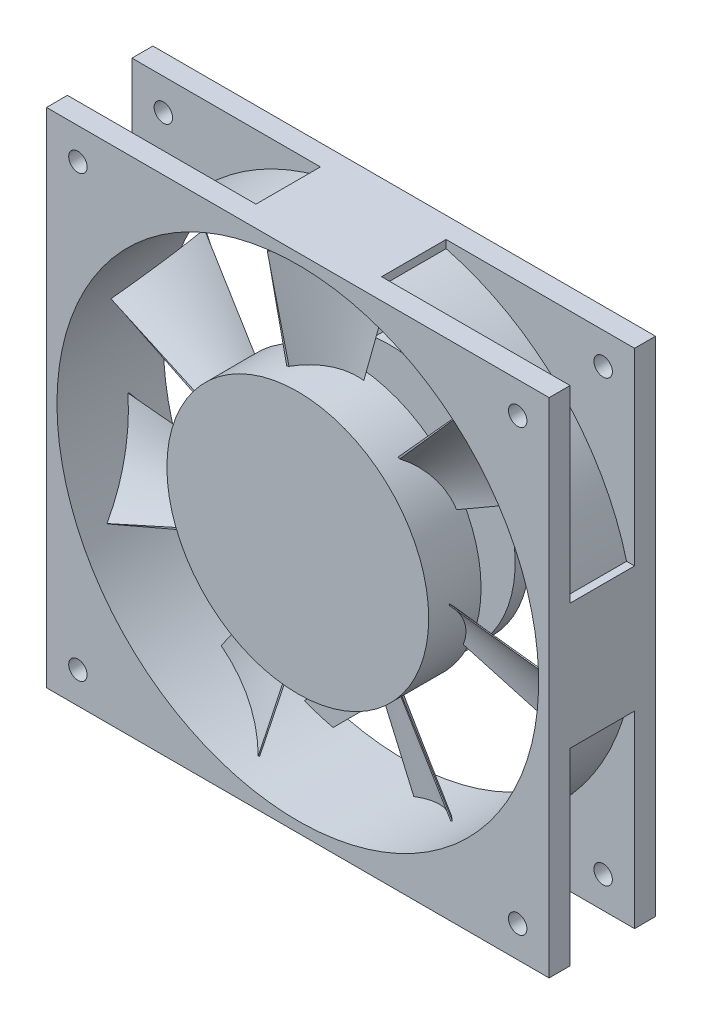
from build123d import *

# Parameters (mm, degrees)
SKETCH1_R          = 60
EXTRUDE1_DEPTH     = 12.7
SKETCH2_W          = 120
SKETCH2_H          = 120
EXTRUDE2_DEPTH     = 5
SKETCH3_W          = 120
SKETCH3_H          = 120
EXTRUDE3_DEPTH     = 5
SKETCH4_W          = 25.4
SKETCH4_H          = 30
EXTRUDE4_DEPTH     = 120
SKETCH5_W          = 30
SKETCH5_H          = 25.4
EXTRUDE5_DEPTH     = 120
SKETCH6_R          = 57.5
CUT_EXTRUDE1_DEPTH = 89.572907822
SKETCH7_R          = 30
EXTRUDE6_DEPTH     = 3.5
EXTRUDE7_DEPTH     = 3.5
CIRPATTERN1_COUNT  = 4
SKETCH9_R          = 5
EXTRUDE8_DEPTH     = 21.9
SKETCH10_R         = 31.25
EXTRUDE9_DEPTH     = 12.5
CIRPATTERN2_COUNT  = 7
SKETCH13_R         = 2.2
CUT_EXTRUDE2_DEPTH = 89.572907822


with BuildPart() as part:
    # Sketch1 → Extrude1 (new, symmetric)
    with BuildSketch(Plane.XY):
        Circle(SKETCH1_R)
    extrude(amount=EXTRUDE1_DEPTH, both=True)

    # Sketch2 → Extrude2 (add)
    with BuildSketch(Plane.XY.offset(12.7)):
        Rectangle(SKETCH2_W, SKETCH2_H)
    extrude(amount=-EXTRUDE2_DEPTH)

    # Sketch3 → Extrude3 (add)
    with BuildSketch(Plane(origin=(0, 0, -12.7), x_dir=(-1, 0, 0), z_dir=(0, 0, -1))):
        Rectangle(SKETCH3_W, SKETCH3_H)
    extrude(amount=-EXTRUDE3_DEPTH)

    # Sketch4 → Extrude4 (add)
    with BuildSketch(Plane.ZY.offset(60)):
        Rectangle(SKETCH4_W, SKETCH4_H)
    extrude(amount=-EXTRUDE4_DEPTH)

    # Sketch5 → Extrude5 (add)
    with BuildSketch(Plane.XZ.offset(60)):
        Rectangle(SKETCH5_W, SKETCH5_H)
    extrude(amount=-EXTRUDE5_DEPTH)

    # Sketch6 → Cut-Extrude1 (cut, through all)
    with BuildSketch(Plane(origin=(0, 0, -12.7), x_dir=(-1, 0, 0), z_dir=(0, 0, -1))):
        Circle(SKETCH6_R)
    extrude(amount=-CUT_EXTRUDE1_DEPTH, mode=Mode.SUBTRACT)



with BuildPart() as body_2:
    # Sketch7 → Extrude6 (new body)
    with BuildSketch(Plane(origin=(0, 0, -12.7), x_dir=(-1, 0, 0), z_dir=(0, 0, -1))):
        Circle(SKETCH7_R)
    extrude(amount=-EXTRUDE6_DEPTH)


with BuildPart() as part_1:
    add(part.part)

    add(body_2.part)  # Extrude7 merges body 2
    # Sketch8 → Extrude7 (add)
    with BuildSketch(Plane(origin=(0, 0, -12.7), x_dir=(-1, 0, 0), z_dir=(0, 0, -1))):
        with BuildLine():
            Line((21.213203436, -21.213203436), (55.899295749, 13.472888878))
            ThreePointArc((55.899295749, 13.472888878), (54.948614382, 16.938116115), (53.783347231, 20.33719648))
            Line((53.783347231, 20.33719648), (29.77446419, -3.67168656))
            ThreePointArc((29.77446419, -3.67168656), (26.960373997, -13.158200255), (21.213203436, -21.213203436))
        make_face()
    extrude7 = extrude(amount=-EXTRUDE7_DEPTH)

    # CirPattern1: Extrude7 ×4 about axis
    cirpattern1_axis = Axis((0, 0, 0), (0, 0, 1))
    for i in range(1, CIRPATTERN1_COUNT):
        add(extrude7.rotate(cirpattern1_axis, i * 360 / CIRPATTERN1_COUNT))

    # Sketch9 → Extrude8 (add)
    with BuildSketch(Plane.XY.offset(-9.2)):
        with Locations(Location((0, 0, 0), (0, 0, 180))):
            Circle(SKETCH9_R)
    extrude(amount=EXTRUDE8_DEPTH)

    # Sketch10 → Extrude9 (add)
    with BuildSketch(Plane.XY.offset(12.7)):
        Circle(SKETCH10_R)
    extrude(amount=-EXTRUDE9_DEPTH)

    # Sketch11 for Loft1 → Loft1 section 0
    with BuildSketch(Plane(origin=(0, 30, 0), x_dir=(-1, 0, 0), z_dir=(0, 1, 0))):
        with BuildLine():
            Line((-5, 2.2), (-2.702187872, 2.196998932))
            # circular arc as an exact rational Bezier (weights 1, cos(half-angle), 1)
            Bezier((-2.702187872, 2.196998932), (3.345547869, 3.250092001), (7.447201646, 7.817426991), weights=[1, 0.944957529, 1])
            Line((7.447201646, 7.817426991), (7, 7.7))
            Bezier((7, 7.7), (2.121433951, 2.503235016), (-5, 2.2), weights=[1, 0.925967176, 1])
        make_face()
    # Sketch12 for Loft1 → Loft1 section 1
    with BuildSketch(Plane(origin=(0, 53, 0), x_dir=(-1, 0, 0), z_dir=(0, 1, 0))):
        with BuildLine():
            Line((11.132637316, 8.842266819), (10.966090772, 9.028713188))
            Bezier((10.966090772, 9.028713188), (2.185483506, 1.185279176), (-9.463327327, -0.524611822), weights=[1, 0.957765392, 1])
            Line((-9.463327327, -0.524611822), (-9.427019705, -0.771961285))
            Bezier((-9.427019705, -0.771961285), (2.296053085, 0.948830385), (11.132637316, 8.842266819), weights=[1, 0.957765392, 1])
        make_face()
    loft1 = loft()

    # CirPattern2: Loft1 ×7 about axis
    cirpattern2_axis = Axis((0, 0, -9.2), (0, 0, -1))
    for i in range(1, CIRPATTERN2_COUNT):
        add(loft1.rotate(cirpattern2_axis, i * 360 / CIRPATTERN2_COUNT))

    # Sketch13 → Cut-Extrude2 (cut, through all)
    with BuildSketch(Plane.XY.offset(12.7)):
        with Locations((-52.5, 52.5)):
            Circle(SKETCH13_R)
        with Locations((-52.5, -52.5)):
            Circle(SKETCH13_R)
        with Locations((52.5, -52.5)):
            Circle(SKETCH13_R)
        with Locations((52.5, 52.5)):
            Circle(SKETCH13_R)
    extrude(amount=-CUT_EXTRUDE2_DEPTH, mode=Mode.SUBTRACT)


solid = part_1.part
